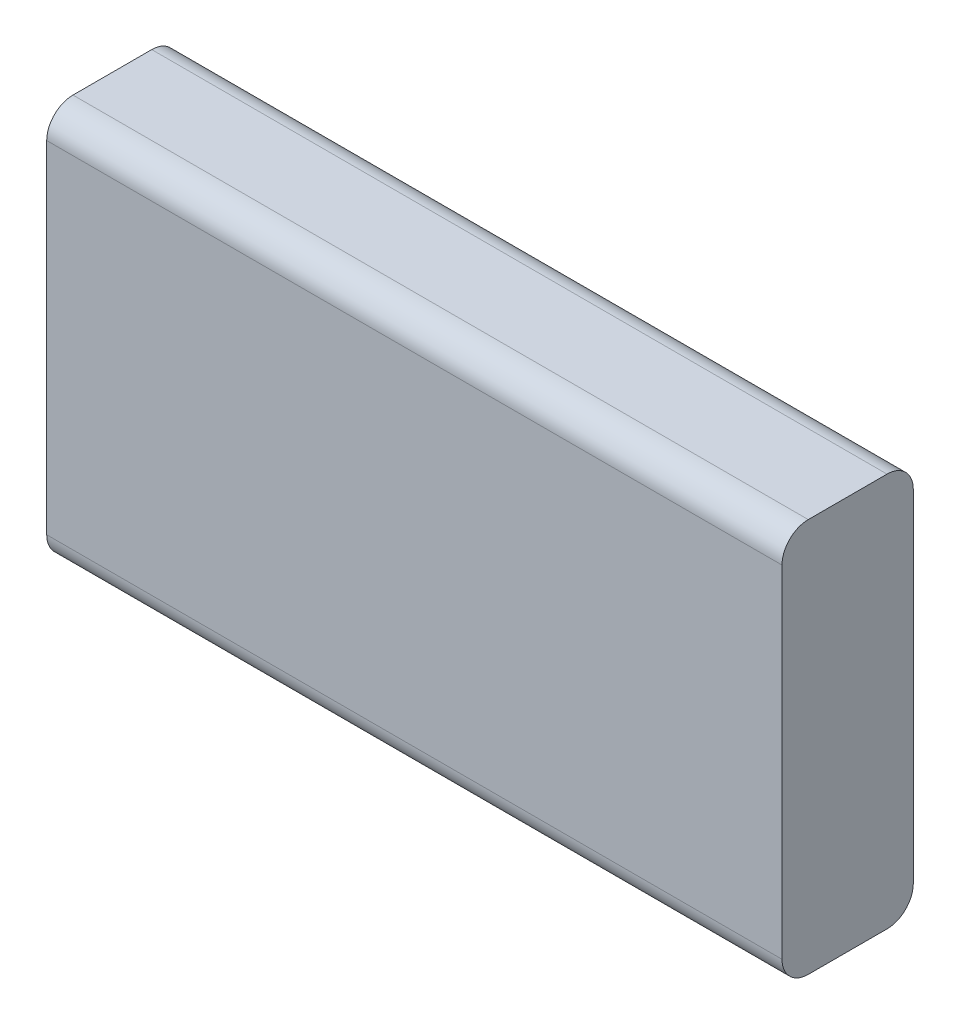
from build123d import *

# Parameters (mm, degrees)
SKIZZE1_W                       = 56
SKIZZE1_H                       = 30
AUFSATZ_LINEAR_AUSTRAGEN1_DEPTH = 10
VERRUNDUNG1_R                   = 2


with BuildPart() as part:
    # Skizze1 → Aufsatz-Linear austragen1 (new body)
    with BuildSketch(Plane.XY):
        with Locations((28, 15)):
            Rectangle(SKIZZE1_W, SKIZZE1_H)
    extrude(amount=AUFSATZ_LINEAR_AUSTRAGEN1_DEPTH)

    # Verrundung1
    verrundung1_edges = [part.edges().sort_by_distance(p)[0] for p in [
        (28, 30, 10),
        (28, 30, 0),
        (28, 0, 0),
        (28, 0, 10),
    ]]
    fillet(verrundung1_edges, radius=VERRUNDUNG1_R)


solid = part.part
